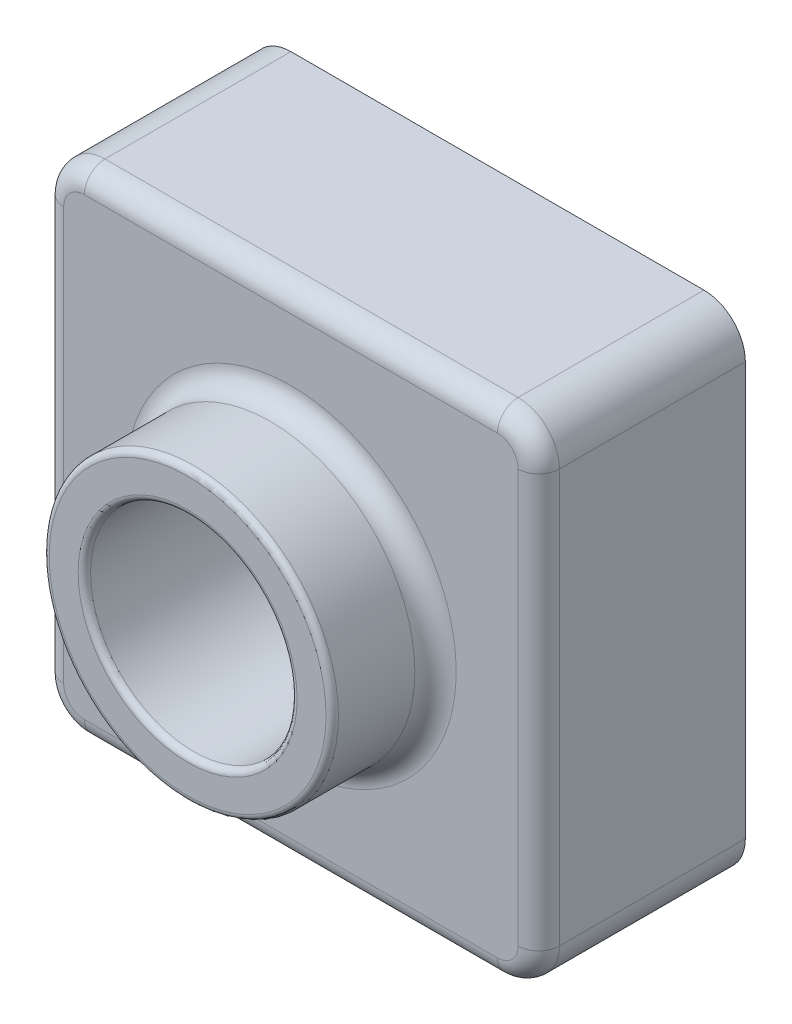
from build123d import *

# Parameters (mm, degrees)
SKETCH1_W           = 120
SKETCH1_H           = 120
BOSS_EXTRUDE1_DEPTH = 50
SKETCH2_R           = 35
BOSS_EXTRUDE2_DEPTH = 25
SKETCH3_R           = 25
CUT_EXTRUDE1_DEPTH  = 186.539753153
FILLET1_R           = 10
FILLET2_R           = 1.5
FILLET3_R           = 5
SHELL1_T            = -2


with BuildPart() as part:
    # Sketch1 → Boss-Extrude1 (new body)
    with BuildSketch(Plane.XY):
        with Locations((60, 60)):
            Rectangle(SKETCH1_W, SKETCH1_H)
    extrude(amount=BOSS_EXTRUDE1_DEPTH)

    # Sketch2 → Boss-Extrude2 (add)
    with BuildSketch(Plane.XY.offset(50)):
        with Locations(Location((60, 60, 0), (0, 0, 180))):
            Circle(SKETCH2_R)
    extrude(amount=BOSS_EXTRUDE2_DEPTH)

    # Sketch3 → Cut-Extrude1 (cut, through all)
    with BuildSketch(Plane.XY.offset(75)):
        with Locations((60, 60)):
            Circle(SKETCH3_R)
    extrude(amount=-CUT_EXTRUDE1_DEPTH, mode=Mode.SUBTRACT)

    # Fillet1
    fillet1_edges = [part.edges().sort_by_distance(p)[0] for p in [
        (0, 120, 25),
        (120, 120, 25),
        (120, 0, 25),
        (0, 0, 25),
    ]]
    fillet(fillet1_edges, radius=FILLET1_R)

    # Fillet2
    fillet2_edges = [part.edges().sort_by_distance(p)[0] for p in [
        (95, 60, 75),
        (35, 60, 75),
    ]]
    fillet(fillet2_edges, radius=FILLET2_R)

    # Fillet3
    fillet3_edges = [part.edges().sort_by_distance(p)[0] for p in [
        (95, 60, 50),
        (60, 0, 50),
        (0, 60, 50),
        (120, 60, 50),
        (60, 120, 50),
        (117.071067812, 117.071067812, 50),
        (2.928932188, 117.071067812, 50),
        (117.071067812, 2.928932188, 50),
        (2.928932188, 2.928932188, 50),
    ]]
    fillet(fillet3_edges, radius=FILLET3_R)

    # Shell1
    shell1_openings = [part.faces().sort_by_distance(p)[0] for p in [
        (60, 1.697056275, 0),
    ]]
    offset(amount=SHELL1_T, openings=shell1_openings, kind=Kind.INTERSECTION)


solid = part.part
